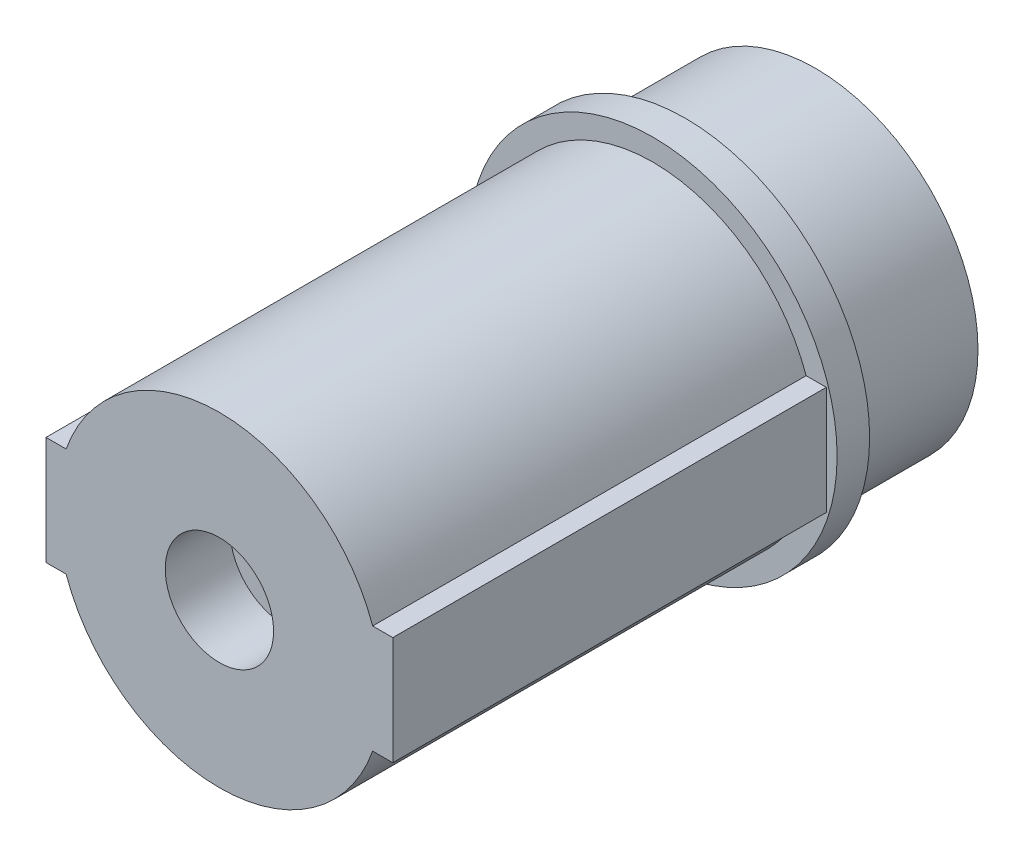
from build123d import *

# Parameters (mm, degrees)
SKETCH1_R           = 15
BOSS_EXTRUDE1_DEPTH = 55
SKETCH2_R           = 10
CUT_EXTRUDE7_DEPTH  = 46
SKETCH7_R           = 5
CUT_EXTRUDE8_DEPTH  = 6
SKETCH8_R           = 2.25
CUT_EXTRUDE9_DEPTH  = 3
BOSS_EXTRUDE5_START = 6
BOSS_EXTRUDE5_DEPTH = 6
BOSS_EXTRUDE6_START = -3
SKETCH11_R          = 17
SKETCH11_R_2        = 15
BOSS_EXTRUDE6_DEPTH = 3
BOSS_EXTRUDE8_START = -40
BOSS_EXTRUDE8_DEPTH = 40


with BuildPart() as part:
    # Sketch1 → Boss-Extrude1 (new body)
    with BuildSketch(Plane.XY):
        Circle(SKETCH1_R)
    extrude(amount=BOSS_EXTRUDE1_DEPTH)

    # Sketch2 → Cut-Extrude7 (cut)
    with BuildSketch(Plane(origin=(0, 0, 0), x_dir=(-1, 0, 0), z_dir=(0, 0, -1))):
        Circle(SKETCH2_R)
    extrude(amount=-CUT_EXTRUDE7_DEPTH, mode=Mode.SUBTRACT)

    # Sketch7 → Cut-Extrude8 (cut)
    with BuildSketch(Plane.XY.offset(55)):
        Circle(SKETCH7_R)
    extrude(amount=-CUT_EXTRUDE8_DEPTH, mode=Mode.SUBTRACT)

    # Sketch8 → Cut-Extrude9 (cut)
    with BuildSketch(Plane.XY.offset(49)):
        Circle(SKETCH8_R)
    extrude(amount=-CUT_EXTRUDE9_DEPTH, mode=Mode.SUBTRACT)

    # Sketch9 → Boss-Extrude5 (add)
    with BuildSketch(Plane(origin=(0, 0, 46), x_dir=(-1, 0, 0), z_dir=(0, 0, -1)).offset(BOSS_EXTRUDE5_START)):
        with BuildLine():
            Line((-9.682458366, -2.5), (-6.5, -2.5))
            Line((-6.5, -2.5), (-6.5, -7.599342077))
            ThreePointArc((-6.5, -7.599342077), (-8.48344341, -5.294448782), (-9.682458366, -2.5))
        make_face()
        with BuildLine():
            Line((-9.682458366, 2.5), (-6.5, 2.5))
            Line((-6.5, 2.5), (-6.5, 7.599342077))
            ThreePointArc((-6.5, 7.599342077), (-8.48344341, 5.294448782), (-9.682458366, 2.5))
        make_face()
        with BuildLine():
            Line((9.682458366, -2.5), (6.5, -2.5))
            Line((6.5, -2.5), (6.5, -7.599342077))
            ThreePointArc((6.5, -7.599342077), (8.48344341, -5.294448782), (9.682458366, -2.5))
        make_face()
        with BuildLine():
            Line((6.5, 2.5), (6.5, 7.599342077))
            ThreePointArc((6.5, 7.599342077), (8.48344341, 5.294448782), (9.682458366, 2.5))
            Line((9.682458366, 2.5), (6.5, 2.5))
        make_face()
    extrude(amount=-BOSS_EXTRUDE5_DEPTH)

    # Sketch11 → Boss-Extrude6 (add)
    with BuildSketch(Plane.XY.offset(15).offset(BOSS_EXTRUDE6_START)):
        Circle(SKETCH11_R)
        Circle(SKETCH11_R_2, mode=Mode.SUBTRACT)
    extrude(amount=BOSS_EXTRUDE6_DEPTH)

    # Sketch10 → Boss-Extrude8 (add)
    with BuildSketch(Plane.XY.offset(55).offset(BOSS_EXTRUDE8_START)):
        with BuildLine():
            Line((16, 5), (14.142135624, 5))
            ThreePointArc((14.142135624, 5), (15, 0), (14.142135624, -5))
            Line((14.142135624, -5), (16, -5))
            Line((16, -5), (16, 5))
        make_face()
        with BuildLine():
            ThreePointArc((-14.142135624, 5), (-15, 0), (-14.142135624, -5))
            Line((-14.142135624, -5), (-16, -5))
            Line((-16, -5), (-16, 5))
            Line((-16, 5), (-14.142135624, 5))
        make_face()
    extrude(amount=BOSS_EXTRUDE8_DEPTH)


solid = part.part
